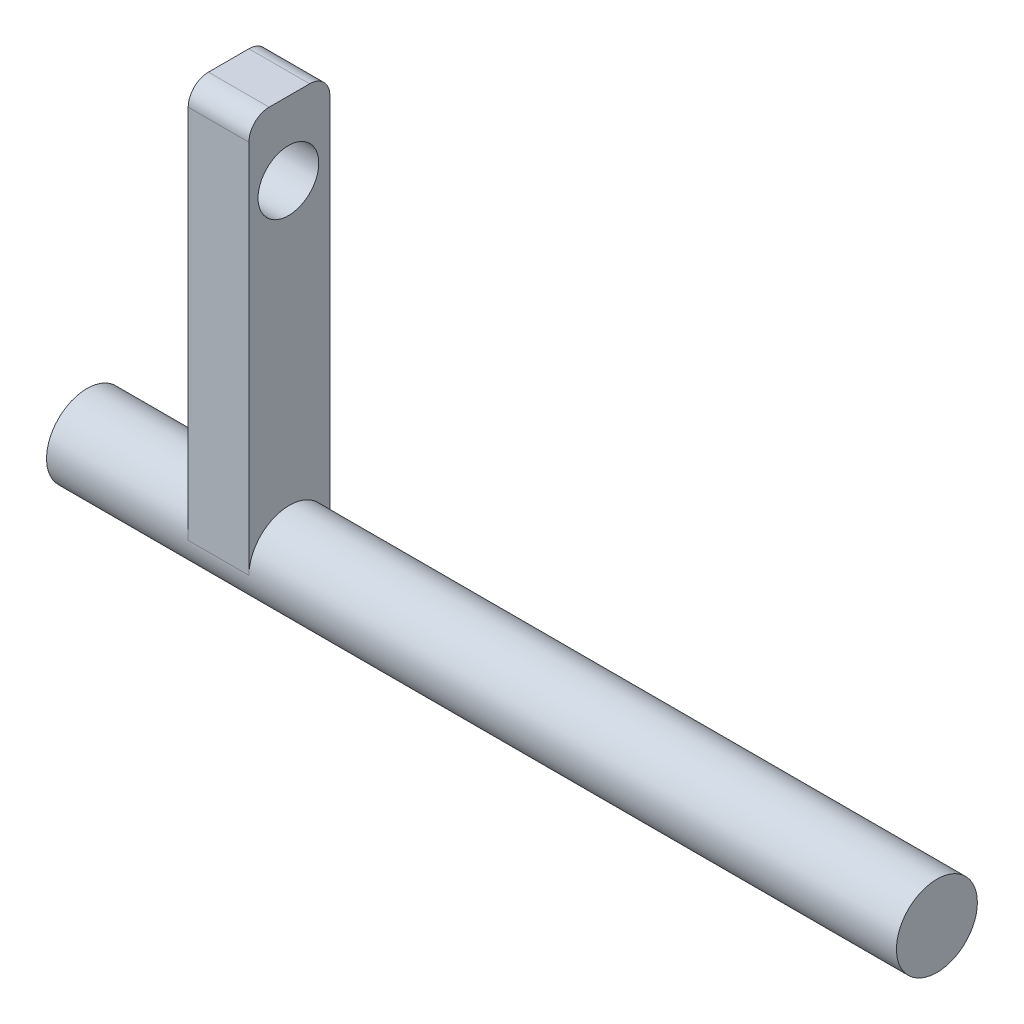
from build123d import *
from build123d.topology import SkipClean

# Parameters (mm, degrees)
SKETCH1_R           = 2
BOSS_EXTRUDE1_DEPTH = 42
BOSS_EXTRUDE2_DEPTH = 10
CUT_EXTRUDE1_DEPTH  = 7
BOSS_EXTRUDE4_DEPTH = 3
SKETCH5_R           = 1.5
CUT_EXTRUDE3_DEPTH  = 54.708670792
SKETCH6_W           = 11.822480184
SKETCH6_H           = 12.15707868
CUT_EXTRUDE5_DEPTH  = 54.708670792
FILLET4_R           = 1
FILLET5_R           = 1


with BuildPart() as part:
    # Sketch1 → Boss-Extrude1 (new body)
    with BuildSketch(Plane(origin=(0, 0, 0), x_dir=(0, 0, -1), z_dir=(1, 0, 0))):
        with Locations(Location((-12.6584653, 7.000514901, 0), (0, 0, 180))):
            Circle(SKETCH1_R)
    extrude(amount=BOSS_EXTRUDE1_DEPTH)

    # Sketch2 → Boss-Extrude2 (add)
    with BuildSketch(Plane.ZY):
        with BuildLine():
            Line((10.6584653, 7.000514901), (10.6584653, 13.760469307))
            ThreePointArc((10.6584653, 13.760469307), (12.6584653, 15.760469307), (14.6584653, 13.760469307))
            Line((14.6584653, 13.760469307), (14.6584653, 7.000514901))
            ThreePointArc((14.6584653, 7.000514901), (12.6584653, 5.000514901), (10.6584653, 7.000514901))
        make_face()
    extrude(amount=-BOSS_EXTRUDE2_DEPTH)

    # Sketch3 → Cut-Extrude1 (cut)
    with SkipClean():  # the faces are left unmerged after this step: merging them gives an invalid solid
        with BuildSketch(Plane.ZY):
            with BuildLine():
                Line((10.6584653, 7.000514901), (10.6584653, 13.760469307))
                ThreePointArc((10.6584653, 13.760469307), (12.6584653, 15.760469307), (14.6584653, 13.760469307))
                Line((14.6584653, 13.760469307), (14.6584653, 7.000514901))
                ThreePointArc((14.6584653, 7.000514901), (12.6584653, 9.000514901), (10.6584653, 7.000514901))
            make_face()
        extrude(amount=-CUT_EXTRUDE1_DEPTH, mode=Mode.SUBTRACT)

    # Sketch4 → Boss-Extrude4 (add)
    with SkipClean():  # the faces are left unmerged after this step: merging them gives an invalid solid
        with BuildSketch(Plane.ZY.offset(-7)):
            with BuildLine():
                Line((10.6584653, 36.009876522), (10.6584653, 13.760469307))
                ThreePointArc((10.6584653, 13.760469307), (12.6584653, 15.760469307), (14.6584653, 13.760469307))
                Line((14.6584653, 13.760469307), (14.6584653, 36.009876522))
                Line((14.6584653, 36.009876522), (10.6584653, 36.009876522))
            make_face()
            with BuildLine():
                ThreePointArc((10.6584653, 36.009876522), (12.6584653, 38.009876522), (14.6584653, 36.009876522))
                Line((14.6584653, 36.009876522), (10.6584653, 36.009876522))
            make_face()
        extrude(amount=-BOSS_EXTRUDE4_DEPTH)

    # Sketch5 → Cut-Extrude3 (cut, through all)
    with SkipClean():  # the faces are left unmerged after this step: merging them gives an invalid solid
        with BuildSketch(Plane.ZY.offset(-7)):
            with Locations((12.706639089, 22.91954594)):
                Circle(SKETCH5_R)
        extrude(amount=-CUT_EXTRUDE3_DEPTH, mode=Mode.SUBTRACT)

    # Sketch6 → Cut-Extrude5 (cut, through all)
    with SkipClean():  # the faces are left unmerged after this step: merging them gives an invalid solid
        with BuildSketch(Plane.ZY.offset(-7)):
            with Locations((12.630555797, 32.616849438)):
                Rectangle(SKETCH6_W, SKETCH6_H)
        extrude(amount=-CUT_EXTRUDE5_DEPTH, mode=Mode.SUBTRACT)

    # Fillet4
    fillet4_edges = [part.edges().sort_by_distance(p)[0] for p in [
        (8.5, 26.538310098, 14.6584653),
    ]]
    fillet(fillet4_edges, radius=FILLET4_R)

    # Fillet5
    fillet5_edges = [part.edges().sort_by_distance(p)[0] for p in [
        (8.5, 26.538310098, 10.6584653),
    ]]
    fillet(fillet5_edges, radius=FILLET5_R)


solid = part.part
